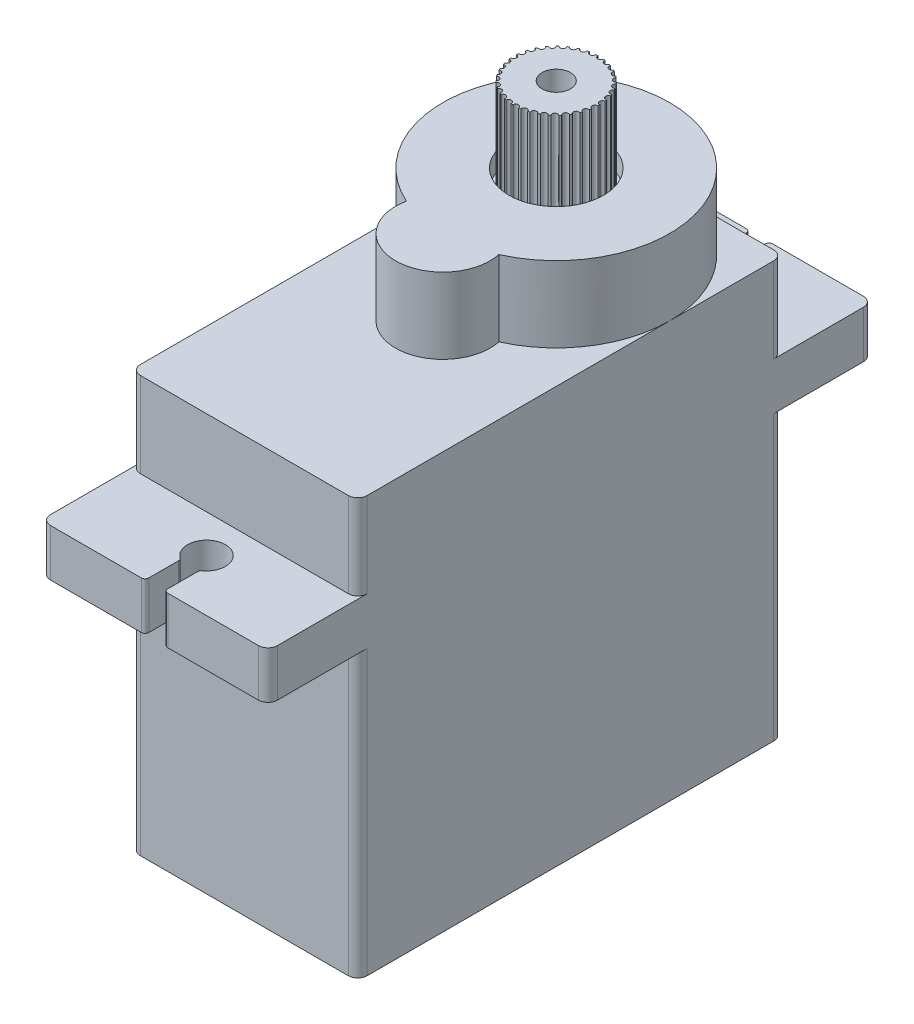
from build123d import *

# Parameters (mm, degrees)
Y_KSEKLIK_EKSTR_ZYON1_DEPTH  = 1
Y_KSEKLIK_EKSTR_ZYON2_DEPTH  = 5
IZIM3_W                      = 4
IZIM3_H                      = 1
KES_EKSTR_ZYON1_DEPTH        = 1
RADYUS1_R                    = 0.1
Y_KSEKLIK_EKSTR_ZYON4_DEPTH  = 9
Y_KSEKLIK_EKSTR_ZYON5_DEPTH  = 2.5
Y_KSEKLIK_EKSTR_ZYON6_DEPTH  = 3.5
Y_KSEKLIK_EKSTR_ZYON7_DEPTH  = 1
KES_EKSTR_ZYON2_DEPTH        = 1
Y_KSEKLIK_EKSTR_ZYON8_START  = 3
Y_KSEKLIK_EKSTR_ZYON8_DEPTH  = 3
RADYUS2_R                    = 0.5
Y_KSEKLIK_EKSTR_ZYON9_START  = 1
Y_KSEKLIK_EKSTR_ZYON9_DEPTH  = 1
IZIM11_R                     = 2.5
KES_EKSTR_ZYON3_DEPTH        = 10
IZIM15_R                     = 0.25
Y_KSEKLIK_EKSTR_ZYON12_DEPTH = 11
IZIM19_R                     = 2.25
Y_KSEKLIK_EKSTR_ZYON17_DEPTH = 5
IZIM20_R                     = 4.75
Y_KSEKLIK_EKSTR_ZYON18_DEPTH = 3
IZIM21_R                     = 0.75
KES_EKSTR_ZYON5_DEPTH        = 10
IZIM22_R                     = 0.5
Y_KSEKLIK_EKSTR_ZYON19_DEPTH = 5
IZIM23_R                     = 4
Y_KSEKLIK_EKSTR_ZYON20_DEPTH = 2
IZIM24_R                     = 0.75
Y_KSEKLIK_EKSTR_ZYON21_DEPTH = 7
IZIM25_R                     = 3.5
Y_KSEKLIK_EKSTR_ZYON22_DEPTH = 1
IZIM26_R                     = 4.5
Y_KSEKLIK_EKSTR_ZYON23_DEPTH = 1
KES_EKSTR_ZYON7_DEPTH        = 30
Y_KSEKLIK_EKSTR_ZYON33_DEPTH = 1
Y_KSEKLIK_EKSTR_ZYON34_DEPTH = 14
IZIM37_W                     = 8
IZIM37_H                     = 6
Y_KSEKLIK_EKSTR_ZYON36_DEPTH = 1
IZIM39_W                     = 4
IZIM39_H                     = 1
Y_KSEKLIK_EKSTR_ZYON37_DEPTH = 0.1
IZIM40_R                     = 0.4
Y_KSEKLIK_EKSTR_ZYON38_DEPTH = 2
IZIM41_R                     = 0.15
KES_EKSTR_ZYON8_DEPTH        = 5


with BuildPart() as part:
    # Çizim1 → Yükseklik-Ekstrüzyon1 (new body)
    with BuildSketch(Plane(origin=(0, 0, 0), x_dir=(1, 0, 0), z_dir=(0, 1, 0))):
        with BuildLine():
            Line((-5.5, 11.25), (5.5, 11.25))
            ThreePointArc((5.5, 11.25), (5.853553391, 11.103553391), (6, 10.75))
            Line((6, 10.75), (6, -10.75))
            ThreePointArc((6, -10.75), (5.853553391, -11.103553391), (5.5, -11.25))
            Line((5.5, -11.25), (-5.5, -11.25))
            ThreePointArc((-5.5, -11.25), (-5.853553391, -11.103553391), (-6, -10.75))
            Line((-6, -10.75), (-6, 10.75))
            ThreePointArc((-6, 10.75), (-5.853553391, 11.103553391), (-5.5, 11.25))
        make_face()
    extrude(amount=Y_KSEKLIK_EKSTR_ZYON1_DEPTH)

    # Çizim2 → Yükseklik-Ekstrüzyon2 (add)
    with BuildSketch(Plane(origin=(0, 1, 0), x_dir=(1, 0, 0), z_dir=(0, 1, 0))):
        with BuildLine():
            Line((-5.5, 11.25), (5.5, 11.25))
            ThreePointArc((5.5, 11.25), (5.853553391, 11.103553391), (6, 10.75))
            Line((6, 10.75), (6, -10.75))
            ThreePointArc((6, -10.75), (5.853553391, -11.103553391), (5.5, -11.25))
            Line((5.5, -11.25), (-5.5, -11.25))
            ThreePointArc((-5.5, -11.25), (-5.853553391, -11.103553391), (-6, -10.75))
            Line((-6, -10.75), (-6, 10.75))
            ThreePointArc((-6, 10.75), (-5.853553391, 11.103553391), (-5.5, 11.25))
        make_face()
        with BuildLine():
            Line((-5, 9.25), (-5, -9.25))
            ThreePointArc((-5, -9.25), (-4.292893219, -9.542893219), (-4, -10.25))
            Line((-4, -10.25), (4, -10.25))
            ThreePointArc((4, -10.25), (4.292893219, -9.542893219), (5, -9.25))
            Line((5, -9.25), (5, 9.25))
            ThreePointArc((5, 9.25), (4.292893219, 9.542893219), (4, 10.25))
            Line((4, 10.25), (-4, 10.25))
            ThreePointArc((-4, 10.25), (-4.292893219, 9.542893219), (-5, 9.25))
        make_face(mode=Mode.SUBTRACT)
    extrude(amount=Y_KSEKLIK_EKSTR_ZYON2_DEPTH)

    # Çizim3 → Kes-Ekstrüzyon1 (cut)
    with BuildSketch(Plane(origin=(0, 6, 0), x_dir=(1, 0, 0), z_dir=(0, 1, 0))):
        with Locations((0, -10.75)):
            Rectangle(IZIM3_W, IZIM3_H)
    extrude(amount=-KES_EKSTR_ZYON1_DEPTH, mode=Mode.SUBTRACT)

    # Radyus1
    radyus1_edges = [part.edges().sort_by_distance(p)[0] for p in [
        (2, 5, 10.75),
        (-2, 5, 10.75),
    ]]
    fillet(radyus1_edges, radius=RADYUS1_R)

    # Çizim4 → Yükseklik-Ekstrüzyon4 (add)
    with BuildSketch(Plane(origin=(0, 6, 0), x_dir=(1, 0, 0), z_dir=(0, 1, 0))):
        with BuildLine():
            Line((-5.5, 11.25), (5.5, 11.25))
            ThreePointArc((5.5, 11.25), (5.853553391, 11.103553391), (6, 10.75))
            Line((6, 10.75), (6, -10.75))
            ThreePointArc((6, -10.75), (5.853553391, -11.103553391), (5.5, -11.25))
            Line((5.5, -11.25), (-5.5, -11.25))
            ThreePointArc((-5.5, -11.25), (-5.853553391, -11.103553391), (-6, -10.75))
            Line((-6, -10.75), (-6, 10.75))
            ThreePointArc((-6, 10.75), (-5.853553391, 11.103553391), (-5.5, 11.25))
        make_face()
        with BuildLine():
            Line((-4, 10.25), (4, 10.25))
            ThreePointArc((4, 10.25), (4.292893219, 9.542893219), (5, 9.25))
            Line((5, 9.25), (5, -9.25))
            ThreePointArc((5, -9.25), (4.292893219, -9.542893219), (4, -10.25))
            Line((4, -10.25), (-4, -10.25))
            ThreePointArc((-4, -10.25), (-4.292893219, -9.542893219), (-5, -9.25))
            Line((-5, -9.25), (-5, 9.25))
            ThreePointArc((-5, 9.25), (-4.292893219, 9.542893219), (-4, 10.25))
        make_face(mode=Mode.SUBTRACT)
    extrude(amount=Y_KSEKLIK_EKSTR_ZYON4_DEPTH)

    # Çizim6 → Yükseklik-Ekstrüzyon5 (add)
    with BuildSketch(Plane(origin=(0, 15, 0), x_dir=(1, 0, 0), z_dir=(0, 1, 0))):
        with BuildLine():
            Line((-5.5, 16), (-0.7, 16))
            ThreePointArc((-0.7, 16), (-0.558578644, 15.941421356), (-0.5, 15.8))
            Line((-0.5, 15.8), (-0.5, 14.224679434))
            ThreePointArc((-0.5, 14.224679434), (-0.522048696, 14.133392342), (-0.583333333, 14.062232862))
            ThreePointArc((-0.583333333, 14.062232862), (0, 12.25), (0.583333333, 14.062232862))
            ThreePointArc((0.583333333, 14.062232862), (0.522048696, 14.133392342), (0.5, 14.224679434))
            Line((0.5, 14.224679434), (0.5, 15.8))
            ThreePointArc((0.5, 15.8), (0.558578644, 15.941421356), (0.7, 16))
            Line((0.7, 16), (5.5, 16))
            ThreePointArc((5.5, 16), (5.853553391, 15.853553391), (6, 15.5))
            Line((6, 15.5), (6, -15.5))
            ThreePointArc((6, -15.5), (5.853553391, -15.853553391), (5.5, -16))
            Line((5.5, -16), (0.7, -16))
            ThreePointArc((0.7, -16), (0.558578644, -15.941421356), (0.5, -15.8))
            Line((0.5, -15.8), (0.5, -14.224679434))
            ThreePointArc((0.5, -14.224679434), (0.522048696, -14.133392342), (0.583333333, -14.062232862))
            ThreePointArc((0.583333333, -14.062232862), (0, -12.25), (-0.583333333, -14.062232862))
            ThreePointArc((-0.583333333, -14.062232862), (-0.522048696, -14.133392342), (-0.5, -14.224679434))
            Line((-0.5, -14.224679434), (-0.5, -15.8))
            ThreePointArc((-0.5, -15.8), (-0.558578644, -15.941421356), (-0.7, -16))
            Line((-0.7, -16), (-5.5, -16))
            ThreePointArc((-5.5, -16), (-5.853553391, -15.853553391), (-6, -15.5))
            Line((-6, -15.5), (-6, 15.5))
            ThreePointArc((-6, 15.5), (-5.853553391, 15.853553391), (-5.5, 16))
        make_face()
        with BuildLine():
            Line((-4, 10.25), (4, 10.25))
            ThreePointArc((4, 10.25), (4.292893219, 9.542893219), (5, 9.25))
            Line((5, 9.25), (5, -9.25))
            ThreePointArc((5, -9.25), (4.292893219, -9.542893219), (4, -10.25))
            Line((4, -10.25), (-4, -10.25))
            ThreePointArc((-4, -10.25), (-4.292893219, -9.542893219), (-5, -9.25))
            Line((-5, -9.25), (-5, 9.25))
            ThreePointArc((-5, 9.25), (-4.292893219, 9.542893219), (-4, 10.25))
        make_face(mode=Mode.SUBTRACT)
    extrude(amount=Y_KSEKLIK_EKSTR_ZYON5_DEPTH)

    # Çizim7 → Yükseklik-Ekstrüzyon6 (add)
    with BuildSketch(Plane(origin=(0, 17.5, 0), x_dir=(1, 0, 0), z_dir=(0, 1, 0))):
        with BuildLine():
            Line((5.5, 11.25), (-5.5, 11.25))
            ThreePointArc((-5.5, 11.25), (-5.853553391, 11.103553391), (-6, 10.75))
            Line((-6, 10.75), (-6, -10.75))
            ThreePointArc((-6, -10.75), (-5.853553391, -11.103553391), (-5.5, -11.25))
            Line((-5.5, -11.25), (5.5, -11.25))
            ThreePointArc((5.5, -11.25), (5.853553391, -11.103553391), (6, -10.75))
            Line((6, -10.75), (6, 10.75))
            ThreePointArc((6, 10.75), (5.853553391, 11.103553391), (5.5, 11.25))
        make_face()
        with BuildLine():
            Line((-5, -9.25), (-5, 9.25))
            ThreePointArc((-5, 9.25), (-4.292893219, 9.542893219), (-4, 10.25))
            Line((-4, 10.25), (4, 10.25))
            ThreePointArc((4, 10.25), (4.292893219, 9.542893219), (5, 9.25))
            Line((5, 9.25), (5, -9.25))
            ThreePointArc((5, -9.25), (4.292893219, -9.542893219), (4, -10.25))
            Line((4, -10.25), (-4, -10.25))
            ThreePointArc((-4, -10.25), (-4.292893219, -9.542893219), (-5, -9.25))
        make_face(mode=Mode.SUBTRACT)
    extrude(amount=Y_KSEKLIK_EKSTR_ZYON6_DEPTH)

    # Çizim8 → Yükseklik-Ekstrüzyon7 (add)
    with BuildSketch(Plane(origin=(0, 21, 0), x_dir=(1, 0, 0), z_dir=(0, 1, 0))):
        with BuildLine():
            Line((-5.5, 11.25), (5.5, 11.25))
            ThreePointArc((5.5, 11.25), (5.853553391, 11.103553391), (6, 10.75))
            Line((6, 10.75), (6, -10.75))
            ThreePointArc((6, -10.75), (5.853553391, -11.103553391), (5.5, -11.25))
            Line((5.5, -11.25), (-5.5, -11.25))
            ThreePointArc((-5.5, -11.25), (-5.853553391, -11.103553391), (-6, -10.75))
            Line((-6, -10.75), (-6, 10.75))
            ThreePointArc((-6, 10.75), (-5.853553391, 11.103553391), (-5.5, 11.25))
        make_face()
    extrude(amount=Y_KSEKLIK_EKSTR_ZYON7_DEPTH)

    # Çizim9 → Kes-Ekstrüzyon2 (cut)
    with BuildSketch(Plane(origin=(0, 22, 0), x_dir=(1, 0, 0), z_dir=(0, 1, 0))):
        with BuildLine():
            ThreePointArc((1.015291078, 0.354166667), (0, 10.25), (-1.015291078, 0.354166667))
            ThreePointArc((-1.015291078, 0.354166667), (0, -2.25), (1.015291078, 0.354166667))
        make_face()
    extrude(amount=-KES_EKSTR_ZYON2_DEPTH, mode=Mode.SUBTRACT)

    # Çizim9<3> → Yükseklik-Ekstrüzyon8 (add)
    with BuildSketch(Plane(origin=(0, 22, 0), x_dir=(1, 0, 0), z_dir=(0, 1, 0)).offset(Y_KSEKLIK_EKSTR_ZYON8_START)):
        with BuildLine():
            ThreePointArc((2.445144707, -0.229166667), (0, 11.25), (-2.445144707, -0.229166667))
            ThreePointArc((-2.445144707, -0.229166667), (0, -3.25), (2.445144707, -0.229166667))
        make_face()
        with BuildLine():
            ThreePointArc((1.015291078, 0.354166667), (0, 10.25), (-1.015291078, 0.354166667))
            ThreePointArc((-1.015291078, 0.354166667), (0, -2.25), (1.015291078, 0.354166667))
        make_face(mode=Mode.SUBTRACT)
    extrude(amount=-Y_KSEKLIK_EKSTR_ZYON8_DEPTH)

    # Radyus2
    radyus2_edges = [part.edges().sort_by_distance(p)[0] for p in [
        (-1.015291078, 23, -0.354166667),
        (1.015291078, 23, -0.354166667),
    ]]
    fillet(radyus2_edges, radius=RADYUS2_R)

    # Çizim10 → Yükseklik-Ekstrüzyon9 (add)
    with BuildSketch(Plane(origin=(0, 25, 0), x_dir=(1, 0, 0), z_dir=(0, 1, 0)).offset(Y_KSEKLIK_EKSTR_ZYON9_START)):
        with BuildLine():
            ThreePointArc((2.445144707, -0.229166667), (0, 11.25), (-2.445144707, -0.229166667))
            ThreePointArc((-2.445144707, -0.229166667), (0, -3.25), (2.445144707, -0.229166667))
        make_face()
    extrude(amount=-Y_KSEKLIK_EKSTR_ZYON9_DEPTH)

    # Çizim11 → Kes-Ekstrüzyon3 (cut)
    with BuildSketch(Plane(origin=(0, 26, 0), x_dir=(1, 0, 0), z_dir=(0, 1, 0))):
        with Locations(Location((0, 5.25, 0), (0, 0, 270))):
            Circle(IZIM11_R)
    extrude(amount=-KES_EKSTR_ZYON3_DEPTH, mode=Mode.SUBTRACT)

    # Çizim15 → Yükseklik-Ekstrüzyon12 (add)
    with BuildSketch(Plane(origin=(0, 26, 0), x_dir=(1, 0, 0), z_dir=(0, 1, 0))):
        with Locations(Location((0, -0.75, 0), (0, 0, 270))):
            Circle(IZIM15_R)
    extrude(amount=-Y_KSEKLIK_EKSTR_ZYON12_DEPTH)



with BuildPart() as body_2:
    # Çizim19 → Yükseklik-Ekstrüzyon17 (new body)
    with BuildSketch(Plane(origin=(0, 30, 0), x_dir=(1, 0, 0), z_dir=(0, 1, 0))):
        with Locations(Location((0, 5.25, 0), (0, 0, 270))):
            Circle(IZIM19_R)
    extrude(amount=-Y_KSEKLIK_EKSTR_ZYON17_DEPTH)


with BuildPart() as part_1:
    add(part.part)

    add(body_2.part)  # Yükseklik-Ekstrüzyon18 merges body 2
    # Çizim20 → Yükseklik-Ekstrüzyon18 (add)
    with BuildSketch(Plane.XZ.offset(-25)):
        with Locations(Location((0, -5.25, 0), (0, 0, 90))):
            Circle(IZIM20_R)
    extrude(amount=Y_KSEKLIK_EKSTR_ZYON18_DEPTH)

    # Çizim21 → Kes-Ekstrüzyon5 (cut)
    with BuildSketch(Plane(origin=(0, 30, 0), x_dir=(1, 0, 0), z_dir=(0, 1, 0))):
        with Locations(Location((0, 5.25, 0), (0, 0, 270))):
            Circle(IZIM21_R)
    extrude(amount=-KES_EKSTR_ZYON5_DEPTH, mode=Mode.SUBTRACT)

    # Çizim22 → Yükseklik-Ekstrüzyon19 (add)
    with BuildSketch(Plane(origin=(0, 25.5, 0), x_dir=(1, 0, 0), z_dir=(0, 1, 0))):
        with Locations(Location((0, -0.75, 0), (0, 0, 270))):
            Circle(IZIM22_R)
    extrude(amount=-Y_KSEKLIK_EKSTR_ZYON19_DEPTH)

    # Çizim23 → Yükseklik-Ekstrüzyon20 (add)
    with BuildSketch(Plane.XZ.offset(-20.5)):
        with Locations(Location((0, 0.75, 0), (0, 0, 270))):
            Circle(IZIM23_R)
    extrude(amount=Y_KSEKLIK_EKSTR_ZYON20_DEPTH)

    # Çizim26 → Yükseklik-Ekstrüzyon23 (add)
    with BuildSketch(Plane(origin=(0, 17.5, 0), x_dir=(-1, 0, 0), z_dir=(0, -1, 0))):
        with Locations(Location((0, -0.75, 0), (0, 0, 90))):
            Circle(IZIM26_R)
    extrude(amount=Y_KSEKLIK_EKSTR_ZYON23_DEPTH)

    # Çizim32 → Kes-Ekstrüzyon7 (cut)
    with BuildSketch(Plane(origin=(0, 0, 10.25), x_dir=(-1, 0, 0), z_dir=(0, 0, -1))):
        with BuildLine():
            Line((2, 6), (-2, 6))
            Line((-2, 6), (-2, 5.1))
            ThreePointArc((-2, 5.1), (-1.970710678, 5.029289322), (-1.9, 5))
            Line((-1.9, 5), (1.9, 5))
            ThreePointArc((1.9, 5), (1.970710678, 5.029289322), (2, 5.1))
            Line((2, 5.1), (2, 6))
        make_face()
    extrude(amount=KES_EKSTR_ZYON7_DEPTH, mode=Mode.SUBTRACT)

    # Çizim33 → Yükseklik-Ekstrüzyon33 (add)
    with BuildSketch(Plane.XY.offset(11.25)):
        with BuildLine():
            Line((-2, 6), (2, 6))
            Line((2, 6), (2, 5.1))
            ThreePointArc((2, 5.1), (1.970710678, 5.029289322), (1.9, 5))
            Line((1.9, 5), (-1.9, 5))
            ThreePointArc((-1.9, 5), (-1.970710678, 5.029289322), (-2, 5.1))
            Line((-2, 5.1), (-2, 6))
        make_face()
    extrude(amount=-Y_KSEKLIK_EKSTR_ZYON33_DEPTH)

    # Çizim34 → Yükseklik-Ekstrüzyon34 (add)
    with BuildSketch(Plane(origin=(0, 1, 0), x_dir=(1, 0, 0), z_dir=(0, 1, 0))):
        with BuildLine():
            Line((-3, -3.25), (3, -3.25))
            ThreePointArc((3, -3.25), (3.707106781, -3.542893219), (4, -4.25))
            Line((4, -4.25), (4, -8.25))
            ThreePointArc((4, -8.25), (3.707106781, -8.957106781), (3, -9.25))
            Line((3, -9.25), (-3, -9.25))
            ThreePointArc((-3, -9.25), (-3.707106781, -8.957106781), (-4, -8.25))
            Line((-4, -8.25), (-4, -4.25))
            ThreePointArc((-4, -4.25), (-3.707106781, -3.542893219), (-3, -3.25))
        make_face()
    extrude(amount=Y_KSEKLIK_EKSTR_ZYON34_DEPTH)

    # Çizim37 → Yükseklik-Ekstrüzyon36 (add)
    with BuildSketch(Plane(origin=(0, 1, 0), x_dir=(-1, 0, 0), z_dir=(0, -1, 0))):
        with Locations((0, -6.25)):
            Rectangle(IZIM37_W, IZIM37_H)
    extrude(amount=-Y_KSEKLIK_EKSTR_ZYON36_DEPTH)

    # Çizim39 → Yükseklik-Ekstrüzyon37 (add)
    with BuildSketch(Plane(origin=(0, 0, -10.75), x_dir=(-1, 0, 0), z_dir=(0, 0, -1))):
        with Locations((0, 5.514566781)):
            Rectangle(IZIM39_W, IZIM39_H)
    extrude(amount=Y_KSEKLIK_EKSTR_ZYON37_DEPTH)

    # Çizim40 → Yükseklik-Ekstrüzyon38 (add)
    with BuildSketch(Plane(origin=(0, 0, -10.85), x_dir=(-1, 0, 0), z_dir=(0, 0, -1))):
        with Locations((0, 5.55)):
            Circle(IZIM40_R)
        with Locations((1, 5.55)):
            Circle(IZIM40_R)
        with Locations((-1, 5.55)):
            Circle(IZIM40_R)
    extrude(amount=Y_KSEKLIK_EKSTR_ZYON38_DEPTH)

    # Çizim41 → Kes-Ekstrüzyon8 (cut)
    with BuildSketch(Plane(origin=(0, 30, 0), x_dir=(1, 0, 0), z_dir=(0, 1, 0))):
        with BuildLine():
            ThreePointArc((-2.245, 5.100083356), (-2.248749653, 5.175), (-2.25, 5.25))
            ThreePointArc((-2.25, 5.25), (-2.248749653, 5.325), (-2.245, 5.399916644))
            ThreePointArc((-2.245, 5.399916644), (-2.4, 5.25), (-2.245, 5.100083356))
        make_face()
        with BuildLine():
            ThreePointArc((-2.245, 5.100083356), (-2.142180707, 5.145716732), (-2.1, 5.25))
            Line((-2.1, 5.25), (-2.25, 5.25))
            ThreePointArc((-2.25, 5.25), (-2.248749653, 5.175), (-2.245, 5.100083356))
        make_face()
        with BuildLine():
            Line((-2.25, 5.25), (-2.1, 5.25))
            ThreePointArc((-2.1, 5.25), (-2.142180707, 5.354283268), (-2.245, 5.399916644))
            ThreePointArc((-2.245, 5.399916644), (-2.248749653, 5.325), (-2.25, 5.25))
        make_face()
        with Locations((-2.106528459, 6.040593354)):
            Circle(IZIM41_R)
        with Locations((-2.213841574, 5.651753013)):
            Circle(IZIM41_R)
        with Locations((-2.213841574, 4.848246987)):
            Circle(IZIM41_R)
        with Locations((-2.106528459, 4.459406646)):
            Circle(IZIM41_R)
        with Locations((-1.931509786, 4.095976626)):
            Circle(IZIM41_R)
        with Locations((-1.694410799, 3.769637867)):
            Circle(IZIM41_R)
        with Locations((-1.402852054, 3.490879164)):
            Circle(IZIM41_R)
        with Locations((-1.066204491, 3.268660053)):
            Circle(IZIM41_R)
        with Locations((-0.695288237, 3.110122838)):
            Circle(IZIM41_R)
        with Locations((-0.302024848, 3.020363036)):
            Circle(IZIM41_R)
        with Locations((0.100945868, 3.0022656)):
            Circle(IZIM41_R)
        with Locations((0.500672101, 3.056412198)):
            Circle(IZIM41_R)
        with Locations((0.884306321, 3.181062512)):
            Circle(IZIM41_R)
        with Locations((1.239518208, 3.372210179)):
            Circle(IZIM41_R)
        with Locations((1.55489096, 3.623711556)):
            Circle(IZIM41_R)
        with Locations((1.820288237, 3.927483182)):
            Circle(IZIM41_R)
        with Locations((2.027179953, 4.273761587)):
            Circle(IZIM41_R)
        with Locations((2.168916437, 4.651417097)):
            Circle(IZIM41_R)
        with Locations((2.240942161, 5.048311555)):
            Circle(IZIM41_R)
        with Locations((2.240942161, 5.451688445)):
            Circle(IZIM41_R)
        with Locations((2.168916437, 5.848582903)):
            Circle(IZIM41_R)
        with Locations((2.027179953, 6.226238413)):
            Circle(IZIM41_R)
        with Locations((1.820288237, 6.572516818)):
            Circle(IZIM41_R)
        with Locations((1.55489096, 6.876288444)):
            Circle(IZIM41_R)
        with Locations((1.239518208, 7.127789821)):
            Circle(IZIM41_R)
        with Locations((0.884306321, 7.318937488)):
            Circle(IZIM41_R)
        with Locations((0.500672101, 7.443587802)):
            Circle(IZIM41_R)
        with Locations((0.100945868, 7.4977344)):
            Circle(IZIM41_R)
        with Locations((-0.302024848, 7.479636964)):
            Circle(IZIM41_R)
        with Locations((-0.695288237, 7.389877162)):
            Circle(IZIM41_R)
        with Locations((-1.066204491, 7.231339947)):
            Circle(IZIM41_R)
        with Locations((-1.402852054, 7.009120836)):
            Circle(IZIM41_R)
        with Locations((-1.694410799, 6.730362133)):
            Circle(IZIM41_R)
        with Locations((-1.931509786, 6.404023374)):
            Circle(IZIM41_R)
    extrude(amount=-KES_EKSTR_ZYON8_DEPTH, mode=Mode.SUBTRACT)


with BuildPart() as body_2_2:
    # Çizim24 → Yükseklik-Ekstrüzyon21 (new body)
    with BuildSketch(Plane.XZ.offset(-22)):
        with Locations(Location((0, -5.25, 0), (0, 0, 270))):
            Circle(IZIM24_R)
    extrude(amount=Y_KSEKLIK_EKSTR_ZYON21_DEPTH)

    # Çizim25 → Yükseklik-Ekstrüzyon22 (add)
    with BuildSketch(Plane(origin=(0, 19, 0), x_dir=(-1, 0, 0), z_dir=(0, -1, 0))):
        with Locations(Location((0, 5.25, 0), (0, 0, 90))):
            Circle(IZIM25_R)
    extrude(amount=Y_KSEKLIK_EKSTR_ZYON22_DEPTH)


solid = Compound([part_1.part, body_2_2.part])
